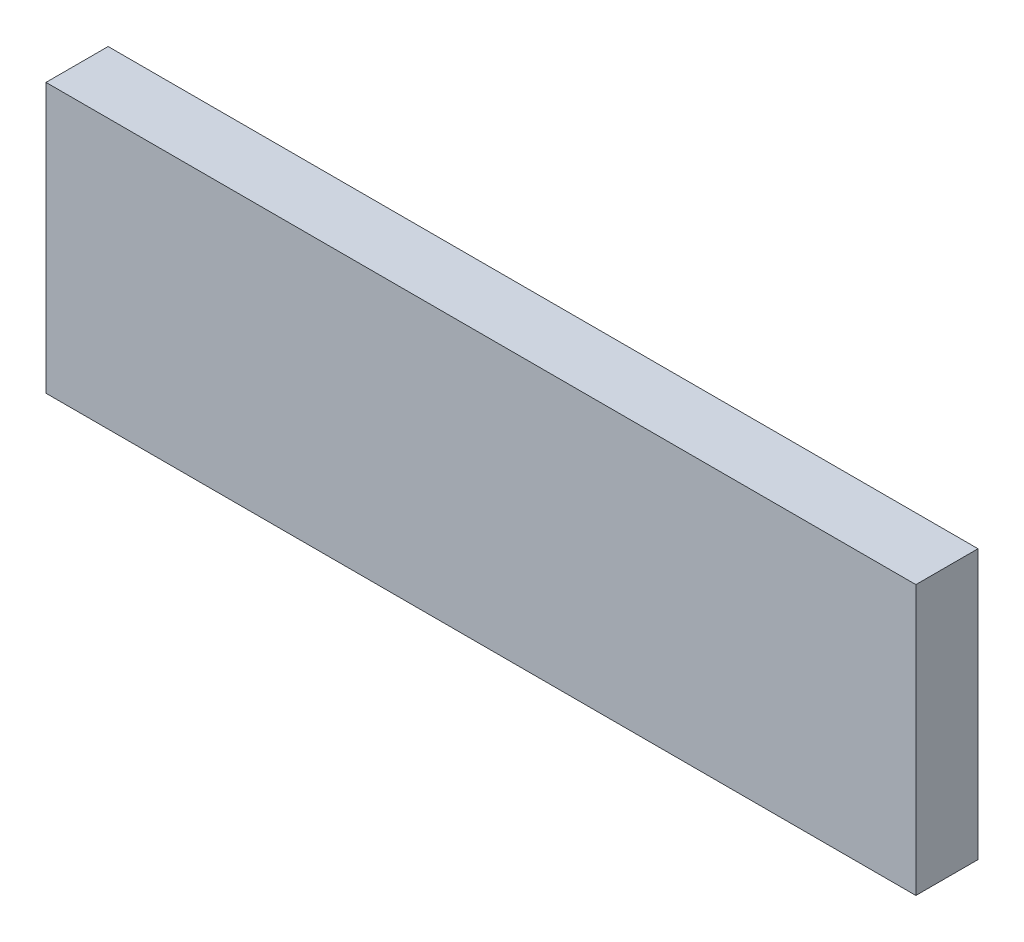
from build123d import *

# Parameters (mm, degrees)
SKETCH1_W           = 42
SKETCH1_H           = 13
BOSS_EXTRUDE1_DEPTH = 3


with BuildPart() as part:
    # Sketch1 → Boss-Extrude1 (new body)
    with BuildSketch(Plane.XY):
        with Locations((21, 6.5)):
            Rectangle(SKETCH1_W, SKETCH1_H)
    extrude(amount=BOSS_EXTRUDE1_DEPTH)


solid = part.part
